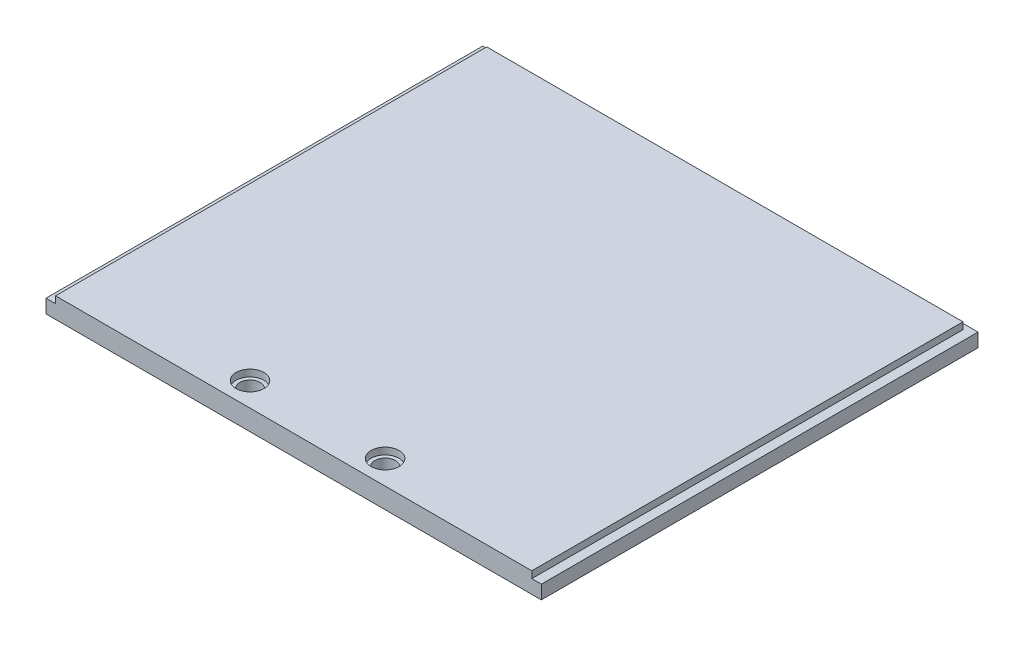
from build123d import *

# Parameters (mm, degrees)
SKETCH1_W           = 72.6
SKETCH1_H           = 64
BOSS_EXTRUDE1_DEPTH = 2
SKETCH2_W           = 69.8
SKETCH2_H           = 63.2
BOSS_EXTRUDE2_DEPTH = 1
HOLE1_D             = 3
HOLE1_CBORE_D       = 4.1
HOLE1_CBORE_DEPTH   = 1


with BuildPart() as part:
    # Sketch1 → Boss-Extrude1 (new body)
    with BuildSketch(Plane(origin=(0, 0, 0), x_dir=(1, 0, 0), z_dir=(0, 1, 0))):
        with Locations((36.3, 32)):
            Rectangle(SKETCH1_W, SKETCH1_H)
    extrude(amount=BOSS_EXTRUDE1_DEPTH)

    # Sketch2 → Boss-Extrude2 (add)
    with BuildSketch(Plane(origin=(0, 2, 0), x_dir=(1, 0, 0), z_dir=(0, 1, 0))):
        with Locations((36.3, 31.6)):
            Rectangle(SKETCH2_W, SKETCH2_H)
    extrude(amount=BOSS_EXTRUDE2_DEPTH)

    # Hole1 (through all)
    with Locations(Plane(origin=(0, 3, 0), x_dir=(1, 0, 0), z_dir=(0, 1, 0))):
        with Locations((26.4, 3.5), (46.2, 3.5)):
            CounterBoreHole(HOLE1_D / 2, HOLE1_CBORE_D / 2, HOLE1_CBORE_DEPTH)


solid = part.part
